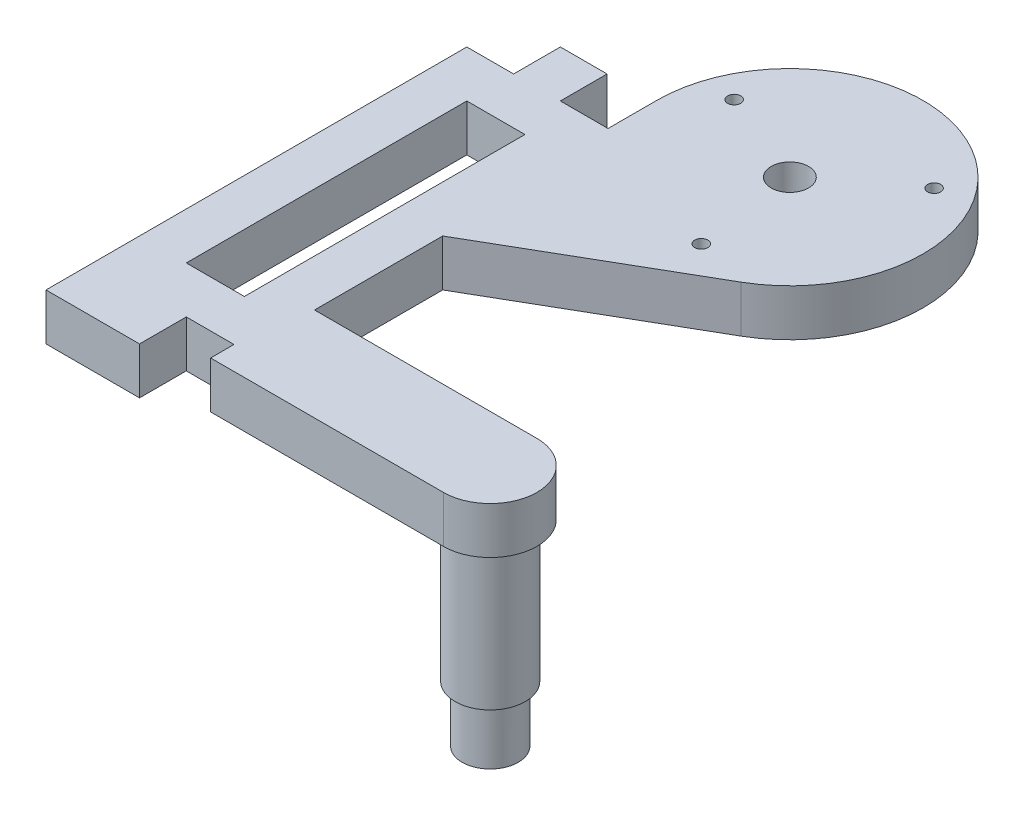
from build123d import *

# Parameters (mm, degrees)
SKETCH2_W           = 6.21325809
SKETCH2_H           = 30
SKETCH2_R           = 0.7
SKETCH2_R_2         = 2
BOSS_EXTRUDE1_DEPTH = 5
SKETCH3_R           = 3.75
BOSS_EXTRUDE2_DEPTH = 20
SKETCH4_R           = 3
SKETCH4_R_2         = 1.75
BOSS_EXTRUDE3_DEPTH = 6


with BuildPart() as part:
    # Sketch2 → Boss-Extrude1 (new body)
    with BuildSketch(Plane(origin=(0, 0, 0), x_dir=(1, 0, 0), z_dir=(0, 1, 0))):
        with BuildLine():
            Line((16.21325809, 7.5), (16.21325809, 21.207579156))
            Line((16.21325809, 21.207579156), (36.445096698, 32.888436623))
            ThreePointArc((36.445096698, 32.888436623), (36.445096698, 57.535631272), (15.1, 45.212033947))
            Line((15.1, 45.212033947), (15.1, 40))
            Line((15.1, 40), (10, 40))
            Line((10, 40), (10, 45))
            Line((10, 45), (5, 45))
            Line((5, 45), (5, 40))
            Line((5, 40), (0, 40))
            Line((0, 40), (0, -5))
            Line((0, -5), (10, -5))
            Line((10, -5), (10, 0))
            Line((10, 0), (15.1, 0))
            Line((15.1, 0), (15.1, -2.5))
            Line((15.1, -2.5), (40, -2.5))
            ThreePointArc((40, -2.5), (45, 2.5), (40, 7.5))
            Line((40, 7.5), (16.21325809, 7.5))
        make_face()
        with Locations((8.106629045, 20)):
            Rectangle(SKETCH2_W, SKETCH2_H, mode=Mode.SUBTRACT)
        with Locations(Location((19.167389608, 49.421551703, 0), (0, 0, 270))):
            Circle(SKETCH2_R, mode=Mode.SUBTRACT)
        with Locations(Location((30.76585258, 34.306140472, 0), (0, 0, 270))):
            Circle(SKETCH2_R, mode=Mode.SUBTRACT)
        with Locations(Location((29.330064466, 45.212033947, 0), (0, 0, 270))):
            Circle(SKETCH2_R_2, mode=Mode.SUBTRACT)
        with Locations(Location((38.056951209, 51.908409667, 0), (0, 0, 270))):
            Circle(SKETCH2_R, mode=Mode.SUBTRACT)
    extrude(amount=BOSS_EXTRUDE1_DEPTH)

    # Sketch3 → Boss-Extrude2 (add)
    with BuildSketch(Plane(origin=(0, 5, 0), x_dir=(1, 0, 0), z_dir=(0, 1, 0))):
        with Locations(Location((40, 2.5, 0), (0, 0, 270))):
            Circle(SKETCH3_R)
    extrude(amount=-BOSS_EXTRUDE2_DEPTH)

    # Sketch4 → Boss-Extrude3 (add)
    with BuildSketch(Plane(origin=(0, -15, 0), x_dir=(-1, 0, 0), z_dir=(0, -1, 0))):
        with Locations(Location((-40, 2.5, 0), (0, 0, 270))):
            Circle(SKETCH4_R)
        with Locations(Location((-40, 2.5, 0), (0, 0, 90))):
            Circle(SKETCH4_R_2, mode=Mode.SUBTRACT)
    extrude(amount=BOSS_EXTRUDE3_DEPTH)


solid = part.part
